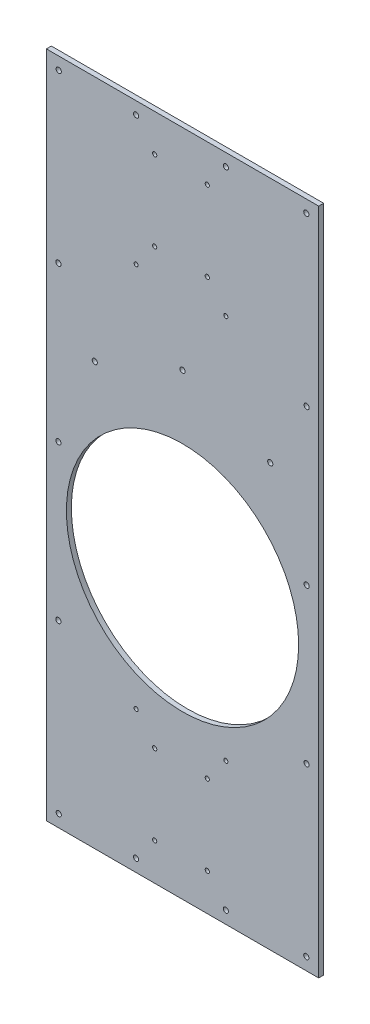
from build123d import *

# Parameters (mm, degrees)
SKETCH_1_W          = 220
SKETCH_1_H          = 540
EXTRUDE_1_DEPTH     = 4
SKETCH_2_R          = 2.1
CUT_EXTRUDE_1_DEPTH = 292.575033225
SKETCH_4_R          = 93.8
CUT_EXTRUDE_2_DEPTH = 10
SKETCH_5_R          = 2.1
CUT_EXTRUDE_3_DEPTH = 10
SKETCH_6_R          = 1.7
SKETCH_6_R_2        = 1.65
CUT_EXTRUDE_5_DEPTH = 292.575033225


with BuildPart() as part:
    # 草图1 → 凸台-拉伸1 (new body)
    with BuildSketch(Plane.XY):
        Rectangle(SKETCH_1_W, SKETCH_1_H)
    extrude(amount=EXTRUDE_1_DEPTH)

    # 草图2 → 切除-拉伸1 (cut, through all)
    with BuildSketch(Plane(origin=(0, 0, 0), x_dir=(-1, 0, 0), z_dir=(0, 0, -1))):
        with Locations((100, -260)):
            Circle(SKETCH_2_R)
        with Locations((-100, -260)):
            Circle(SKETCH_2_R)
        with Locations(Location((100, 260, 0), (0, 0, 180))):
            Circle(SKETCH_2_R)
        with Locations(Location((-100, 260, 0), (0, 0, 180))):
            Circle(SKETCH_2_R)
        with Locations((-35, -260)):
            Circle(SKETCH_2_R)
        with Locations(Location((-35, 260, 0), (0, 0, 180))):
            Circle(SKETCH_2_R)
        with Locations((37.5, 260)):
            Circle(SKETCH_2_R)
        with Locations(Location((37.5, -260, 0), (0, 0, 180))):
            Circle(SKETCH_2_R)
    extrude(amount=-CUT_EXTRUDE_1_DEPTH, mode=Mode.SUBTRACT)

    # 草图4 → 切除-拉伸2 (cut)
    with BuildSketch(Plane.XY.offset(4)):
        with Locations((0, -45)):
            Circle(SKETCH_4_R)
    extrude(amount=-CUT_EXTRUDE_2_DEPTH, mode=Mode.SUBTRACT)

    # 草图5 → 切除-拉伸3 (cut)
    with BuildSketch(Plane.XY.offset(4)):
        with Locations((-100.25, 0)):
            Circle(SKETCH_5_R)
        with Locations((-70.887454814, 70.887454814)):
            Circle(SKETCH_5_R)
        with Locations((0, 100.25)):
            Circle(SKETCH_5_R)
        with Locations((70.887454814, 70.887454814)):
            Circle(SKETCH_5_R)
        with Locations((100.25, 0)):
            Circle(SKETCH_5_R)
        with Locations((70.887454814, -70.887454814)):
            Circle(SKETCH_5_R)
        with Locations((0, -100.25)):
            Circle(SKETCH_5_R)
        with Locations((-70.887454814, -70.887454814)):
            Circle(SKETCH_5_R)
        with Locations((-100.25, -125)):
            Circle(SKETCH_5_R)
        with Locations(Location((100.25, -125, 0), (0, 0, 180))):
            Circle(SKETCH_5_R)
        with Locations(Location((-100.25, 125, 0), (0, 0, 180))):
            Circle(SKETCH_5_R)
        with Locations((100.25, 125)):
            Circle(SKETCH_5_R)
    extrude(amount=-CUT_EXTRUDE_3_DEPTH, mode=Mode.SUBTRACT)

    # 草图6 → 切除-拉伸5 (cut, through all)
    with BuildSketch(Plane(origin=(0, 0, 0), x_dir=(-1, 0, 0), z_dir=(0, 0, -1))):
        with Locations((22.5, 240)):
            Circle(SKETCH_6_R)
        with Locations((-20, 240)):
            Circle(SKETCH_6_R)
        with Locations((22.5, 175.525642791)):
            Circle(SKETCH_6_R)
        with Locations((-20, 175.525642791)):
            Circle(SKETCH_6_R)
        with Locations((-35, 155.525642791)):
            Circle(SKETCH_6_R_2)
        with Locations((37.5, 155.525642791)):
            Circle(SKETCH_6_R_2)
    cut_extrude_5 = extrude(amount=-CUT_EXTRUDE_5_DEPTH, mode=Mode.SUBTRACT)

    # 镜向1: 切除-拉伸5 across plane
    add(cut_extrude_5.mirror(Plane.ZX), mode=Mode.SUBTRACT)


solid = part.part
